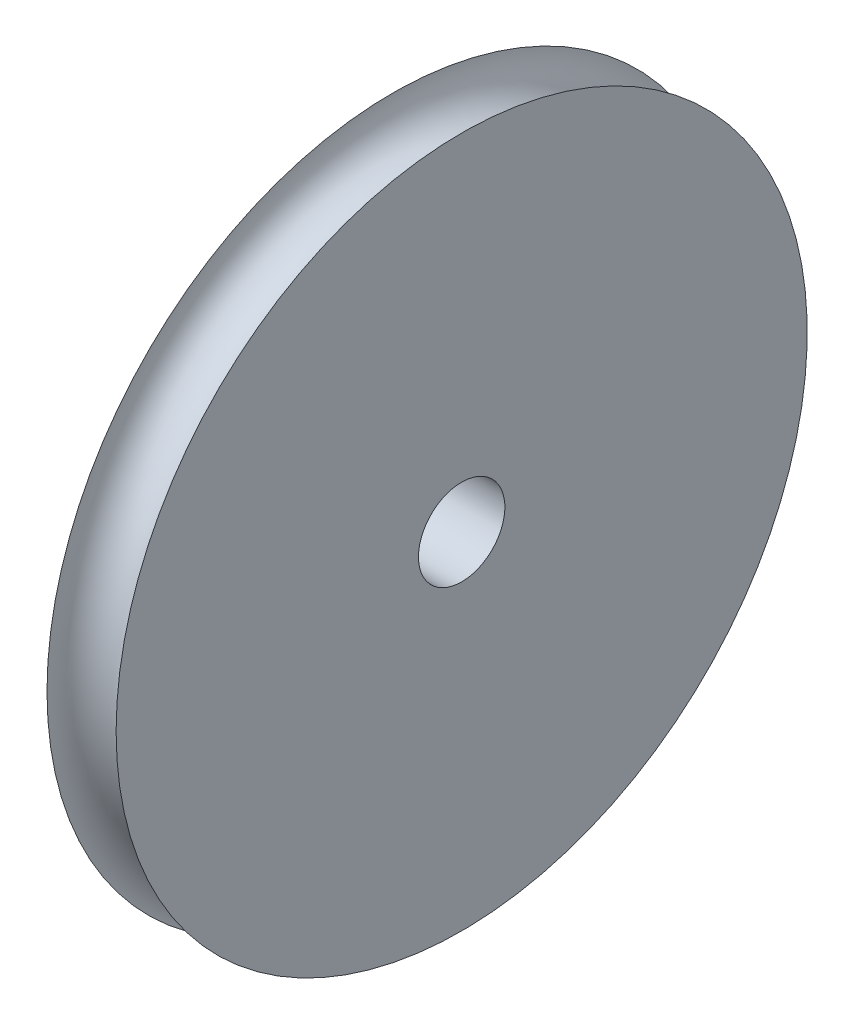
from build123d import *

# Parameters (mm, degrees)
ESQUISSE2_W = 1.25
ESQUISSE2_H = 16


with BuildPart() as part:
    # Esquisse1 → Révolution1 (revolve)
    with BuildSketch(Plane.XY, mode=Mode.PRIVATE) as r_volution1_sk:
        with BuildLine():
            Line((-5.6, 2), (-5.6, 5.5))
            Line((-5.6, 5.5), (-1.6, 5.5))
            Line((-1.6, 5.5), (-1.6, 16))
            ThreePointArc((-1.6, 16), (0, 14.4), (1.6, 16))
            Line((1.6, 16), (1.6, 2))
            Line((1.6, 2), (-5.6, 2))
        make_face()
    revolve(r_volution1_sk.sketch.rotate(Axis((-24.04155074, 0, 0), (1, 0, 0)), 90), axis=Axis((-24.04155074, 0, 0), (1, 0, 0)))

    # Esquisse2 → Trou taraudé M3x0.51 (revolve, cut)
    with BuildSketch(Plane.YZ.offset(-3.6)):
        with Locations((0.625, 8)):
            Rectangle(ESQUISSE2_W, ESQUISSE2_H)
    revolve(axis=Axis((-3.6, 0, -6.35), (0, 0, 1)), mode=Mode.SUBTRACT)


solid = part.part
